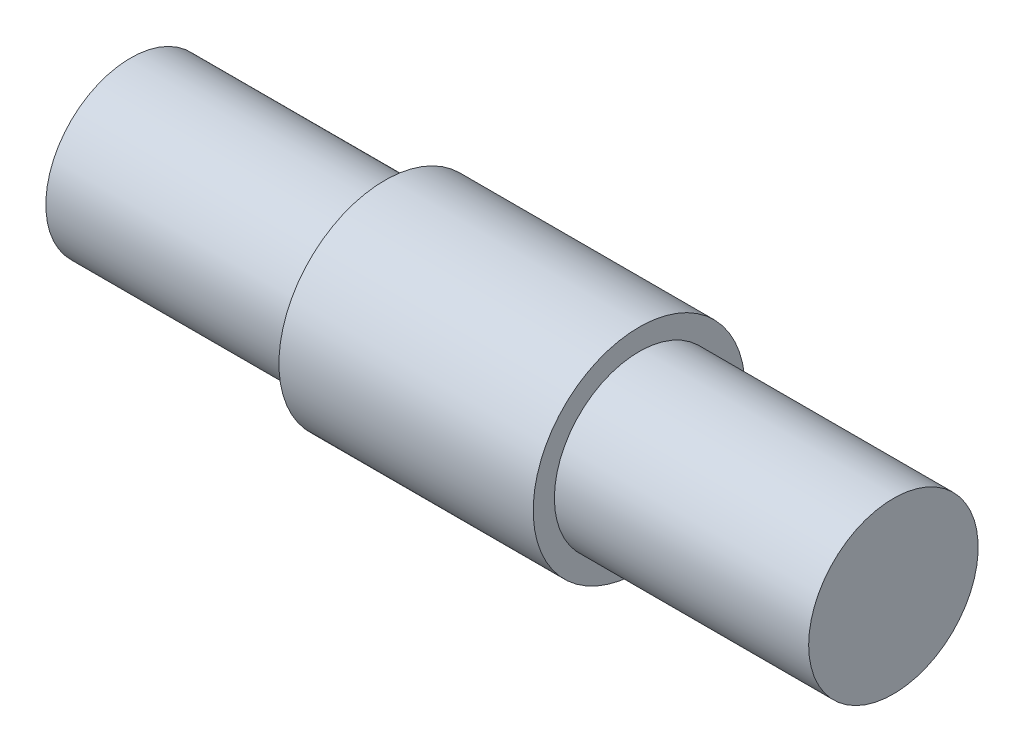
from build123d import *

# Parameters (mm, degrees)
SKETCH2_R           = 3.175
BOSS_EXTRUDE1_DEPTH = 4.7625
SKETCH3_R           = 3.96875
BOSS_EXTRUDE2_DEPTH = 9.525
SKETCH5_R           = 3.175
BOSS_EXTRUDE3_DEPTH = 9.525


with BuildPart() as part:
    # Sketch2 → Boss-Extrude1 (new, symmetric)
    with BuildSketch(Plane(origin=(0, 0, 0), x_dir=(0, 0, -1), z_dir=(1, 0, 0))):
        with Locations(Location((0, 0, 0), (0, 0, 180))):
            Circle(SKETCH2_R)
    extrude(amount=BOSS_EXTRUDE1_DEPTH, both=True)

    # Sketch3 → Boss-Extrude2 (add)
    with BuildSketch(Plane.ZY.offset(4.7625)):
        with Locations(Location((0, 0, 0), (0, 0, 180))):
            Circle(SKETCH3_R)
    extrude(amount=BOSS_EXTRUDE2_DEPTH)

    # Sketch5 → Boss-Extrude3 (add)
    with BuildSketch(Plane.ZY.offset(14.2875)):
        Circle(SKETCH5_R)
    extrude(amount=BOSS_EXTRUDE3_DEPTH)


solid = part.part
